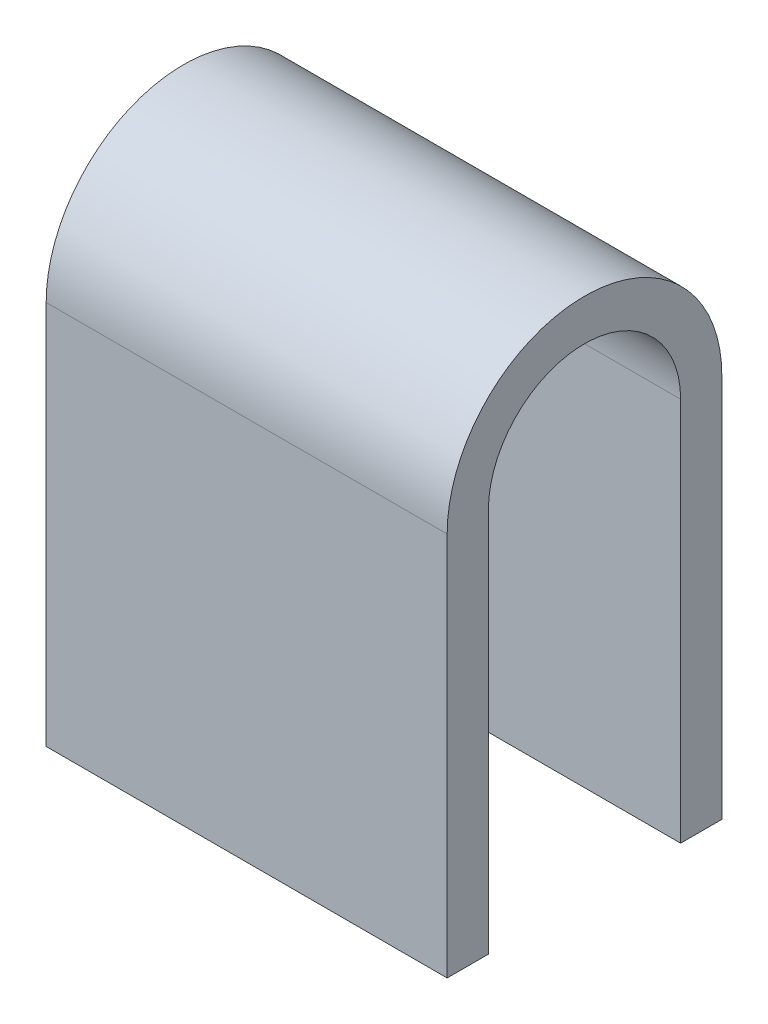
from build123d import *

# Parameters (mm, degrees)
SKETCH1_W           = 18.542
SKETCH1_H           = 17.78
BOSS_EXTRUDE4_DEPTH = 1.905
SKETCH4_W           = 18.542
SKETCH4_H           = 17.78
BOSS_EXTRUDE5_DEPTH = 1.905
BOSS_EXTRUDE6_DEPTH = 18.542


with BuildPart() as part:
    # Sketch1 → Boss-Extrude4 (new body)
    with BuildSketch(Plane.XY):
        Rectangle(SKETCH1_W, SKETCH1_H)
    extrude(amount=-BOSS_EXTRUDE4_DEPTH)



with BuildPart() as body_2:
    # Sketch4 → Boss-Extrude5 (new body)
    with BuildSketch(Plane.XY.offset(-12.7)):
        Rectangle(SKETCH4_W, SKETCH4_H)
    extrude(amount=BOSS_EXTRUDE5_DEPTH)


with BuildPart() as part_1:
    add(part.part)

    add(body_2.part)  # Boss-Extrude6 merges body 2
    # Sketch6 → Boss-Extrude6 (add)
    with BuildSketch(Plane.ZY.offset(9.271)):
        with BuildLine():
            Line((-12.7, 8.89), (-10.795, 8.89))
            ThreePointArc((-10.795, 8.89), (-6.35, 13.335), (-1.905, 8.89))
            Line((-1.905, 8.89), (0, 8.89))
            ThreePointArc((0, 8.89), (-6.35, 15.24), (-12.7, 8.89))
        make_face()
    extrude(amount=-BOSS_EXTRUDE6_DEPTH)


solid = part_1.part
